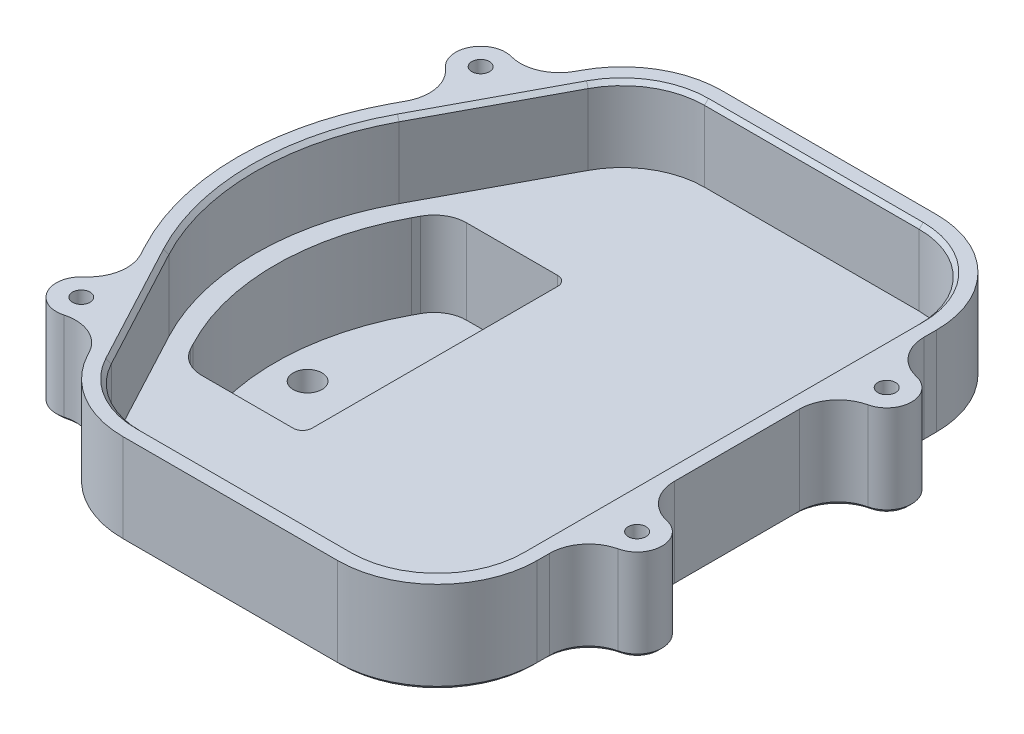
from build123d import *

# Parameters (mm, degrees)
BOSS_EXTRUDE1_DEPTH   = 23.495
FILLET1_R             = 25.4
SHELL1_T              = -4.445
NUB_DEPTH             = 23.368
FILLET2_R             = 12.7
FILLET3_R             = 6.858
CUT_EXTRUDE1_DEPTH    = 21.463
CHAMFER1_SIZE         = 1.016
BOSS_EXTRUDE2_DEPTH   = 23.495
F_8_CLEARANCE_HOLE1_D = 4.4958
CHAMFER2_SIZE         = 1.016
SKETCH14_R            = 3.675
CUT_EXTRUDE2_DEPTH    = 122.72544216


with BuildPart() as part:
    # Sketch1 → Boss-Extrude1 (new body)
    with BuildSketch(Plane(origin=(0, 0, 0), x_dir=(1, 0, 0), z_dir=(0, 1, 0))):
        with BuildLine():
            Line((-25.4, -76.2), (69.85, -76.2))
            Line((69.85, -76.2), (69.85, 76.2))
            Line((69.85, 76.2), (-25.4, 76.2))
            Line((-25.4, 76.2), (-49.305882353, 31.376470588))
            ThreePointArc((-49.305882353, 31.376470588), (-57.15, 0), (-49.305882353, -31.376470588))
            Line((-49.305882353, -31.376470588), (-25.4, -76.2))
        make_face()
    extrude(amount=BOSS_EXTRUDE1_DEPTH)

    # Fillet1
    fillet1_edges = [part.edges().sort_by_distance(p)[0] for p in [
        (69.85, 11.7475, 76.2),
        (-25.4, 11.7475, 76.2),
        (-25.4, 11.7475, -76.2),
        (69.85, 11.7475, -76.2),
    ]]
    fillet(fillet1_edges, radius=FILLET1_R)

    # Shell1
    shell1_openings = [part.faces().sort_by_distance(p)[0] for p in [
        (11.569703313, 23.495, 0),
    ]]
    offset(amount=SHELL1_T, openings=shell1_openings, kind=Kind.INTERSECTION)

    # Sketch13 → nub (add)
    with BuildSketch(Plane.XZ):
        with BuildLine():
            Line((-2.54, 38.1), (-2.54, -38.1))
            Line((-2.54, -38.1), (-40.216666667, -38.1))
            Line((-40.216666667, -38.1), (-44.599411765, -29.882352941))
            ThreePointArc((-44.599411765, -29.882352941), (-52.07, 0), (-44.599411765, 29.882352941))
            Line((-44.599411765, 29.882352941), (-40.216666667, 38.1))
            Line((-40.216666667, 38.1), (-2.54, 38.1))
        make_face()
    extrude(amount=NUB_DEPTH)

    # Fillet2
    fillet2_edges = [part.edges().sort_by_distance(p)[0] for p in [
        (-40.216666667, -11.684, 38.1),
        (-40.216666667, -11.684, -38.1),
    ]]
    fillet(fillet2_edges, radius=FILLET2_R)

    # Fillet3
    fillet3_edges = [part.edges().sort_by_distance(p)[0] for p in [
        (-2.54, -11.684, 38.1),
        (-2.54, -11.684, -38.1),
    ]]
    fillet(fillet3_edges, radius=FILLET3_R)

    # Sketch8 → Cut-Extrude1 (cut)
    with BuildSketch(Plane(origin=(0, 4.445, 0), x_dir=(1, 0, 0), z_dir=(0, 1, 0))):
        with BuildLine():
            Line((-32.596666667, -33.655), (-9.398, -33.655))
            ThreePointArc((-9.398, -33.655), (-7.691751337, -32.948248663), (-6.985, -31.242))
            Line((-6.985, -31.242), (-6.985, 31.242))
            ThreePointArc((-6.985, 31.242), (-7.691751337, 32.948248663), (-9.398, 33.655))
            Line((-9.398, 33.655), (-32.596666667, 33.655))
            ThreePointArc((-32.596666667, 33.655), (-36.843829128, 32.478604102), (-39.880490196, 29.284705882))
            Line((-39.880490196, 29.284705882), (-40.677352941, 27.790588235))
            ThreePointArc((-40.677352941, 27.790588235), (-47.625, 0), (-40.677352941, -27.790588235))
            Line((-40.677352941, -27.790588235), (-39.880490196, -29.284705882))
            ThreePointArc((-39.880490196, -29.284705882), (-36.843829128, -32.478604102), (-32.596666667, -33.655))
        make_face()
    extrude(amount=-CUT_EXTRUDE1_DEPTH, mode=Mode.SUBTRACT)

    # Chamfer1
    chamfer1_edges = [part.edges().sort_by_distance(p)[0] for p in [
        (-37.016764706, 23.495, 44.972941176),
        (-20.941258555, 23.495, 68.768764258),
        (17.145, 23.495, 71.755),
        (59.2674226, 23.495, 65.6174226),
        (65.405, 23.495, 0),
        (59.2674226, 23.495, -65.6174226),
        (17.145, 23.495, -71.755),
        (-20.941258555, 23.495, -68.768764258),
        (-37.016764706, 23.495, -44.972941176),
        (-52.705, 23.495, 0),
    ]]
    chamfer(chamfer1_edges, length=CHAMFER1_SIZE)

    # Sketch10 → Boss-Extrude2 (add)
    with BuildSketch(Plane(origin=(0, 23.495, 0), x_dir=(1, 0, 0), z_dir=(0, 1, 0))):
        with BuildLine():
            Line((69.85, 47.625), (69.85, 15.875))
            ThreePointArc((69.85, 15.875), (72.024192281, 22.073146175), (77.593902439, 25.554878049))
            ThreePointArc((77.593902439, 25.554878049), (82.55, 31.75), (77.593902439, 37.945121951))
            ThreePointArc((77.593902439, 37.945121951), (72.024192281, 41.426853825), (69.85, 47.625))
        make_face()
        with BuildLine():
            Line((69.85, -47.625), (69.85, -15.875))
            ThreePointArc((69.85, -15.875), (72.024192281, -22.073146175), (77.593902439, -25.554878049))
            ThreePointArc((77.593902439, -25.554878049), (82.55, -31.75), (77.593902439, -37.945121951))
            ThreePointArc((77.593902439, -37.945121951), (72.024192281, -41.426853825), (69.85, -47.625))
        make_face()
        with BuildLine():
            Line((-33.069803922, 61.819117647), (-48.010980392, 33.804411765))
            ThreePointArc((-48.010980392, 33.804411765), (-47.012610676, 40.296513581), (-50.288598757, 45.989670014))
            ThreePointArc((-50.288598757, 45.989670014), (-51.74627451, 53.788235294), (-44.457895744, 56.922238164))
            ThreePointArc((-44.457895744, 56.922238164), (-37.904983546, 57.373314449), (-33.069803922, 61.819117647))
        make_face()
        with BuildLine():
            Line((-33.069803922, -61.819117647), (-48.010980392, -33.804411765))
            ThreePointArc((-48.010980392, -33.804411765), (-47.012610676, -40.296513581), (-50.288598757, -45.989670014))
            ThreePointArc((-50.288598757, -45.989670014), (-51.74627451, -53.788235294), (-44.457895744, -56.922238164))
            ThreePointArc((-44.457895744, -56.922238164), (-37.904983546, -57.373314449), (-33.069803922, -61.819117647))
        make_face()
    extrude(amount=-BOSS_EXTRUDE2_DEPTH)

    # #8 Clearance Hole1 (through all)
    with Locations(Plane(origin=(0, 23.495, 0), x_dir=(-1, 0, 0), z_dir=(0, 1, 0))):
        with Locations((46.143333333, -50.8), (46.143333333, 50.8), (-76.2, 31.75), (-76.2, -31.75)):
            Hole(F_8_CLEARANCE_HOLE1_D / 2)

    # Chamfer2
    chamfer2_edges = [part.edges().sort_by_distance(p)[0] for p in [
        (-20.997333333, -23.368, 38.1),
        (-4.548661695, -23.368, 36.091338305),
        (-4.548661695, -23.368, -36.091338305),
        (69.85, 0, -49.2125),
        (72.024192281, 0, -22.073146175),
        (82.55, 0, -31.75),
        (72.024192281, 0, -41.426853825),
        (69.85, 0, 0),
        (72.024192281, 0, 22.073146175),
        (72.024192281, 0, 41.426853825),
        (82.55, 0, 31.75),
        (17.145, 0, 76.2),
        (-48.658431373, 0, -32.590441176),
        (-51.74627451, 0, -53.788235294),
        (-47.012610676, 0, -40.296513581),
        (-37.904983546, 0, -57.373314449),
        (-32.820784314, 0, 62.286029412),
        (-47.012610676, 0, 40.296513581),
        (-51.74627451, 0, 53.788235294),
        (-37.904983546, 0, 57.373314449),
        (69.85, 0, 49.2125),
        (-32.820784314, 0, -62.286029412),
        (17.145, 0, -76.2),
        (-23.228192188, 0, -72.580320313),
        (62.410512242, 0, -68.760512242),
        (62.410512242, 0, 68.760512242),
        (-23.228192188, 0, 72.580320313),
        (-48.658431373, 0, 32.590441176),
        (-57.15, 0, 0),
        (-52.07, -23.368, 0),
        (-44.200980392, -23.368, -30.629411765),
        (-20.997333333, -23.368, -38.1),
        (-44.200980392, -23.368, 30.629411765),
        (-39.130762761, -23.368, 36.290160157),
        (-39.130762761, -23.368, -36.290160157),
        (-2.54, -23.368, 0),
    ]]
    chamfer(chamfer2_edges, length=CHAMFER2_SIZE)

    # Sketch14 → Cut-Extrude2 (cut, through all)
    with BuildSketch(Plane.XZ.offset(23.368)):
        with Locations(Location((-16.51, 22.86, 0), (0, 0, 270))):
            Circle(SKETCH14_R)
        with Locations(Location((-16.51, 0, 0), (0, 0, 270))):
            Circle(SKETCH14_R)
        with Locations(Location((-16.51, -22.86, 0), (0, 0, 270))):
            Circle(SKETCH14_R)
        with Locations(Location((-39.37, 0, 0), (0, 0, 270))):
            Circle(SKETCH14_R)
    extrude(amount=-CUT_EXTRUDE2_DEPTH, mode=Mode.SUBTRACT)


solid = part.part
